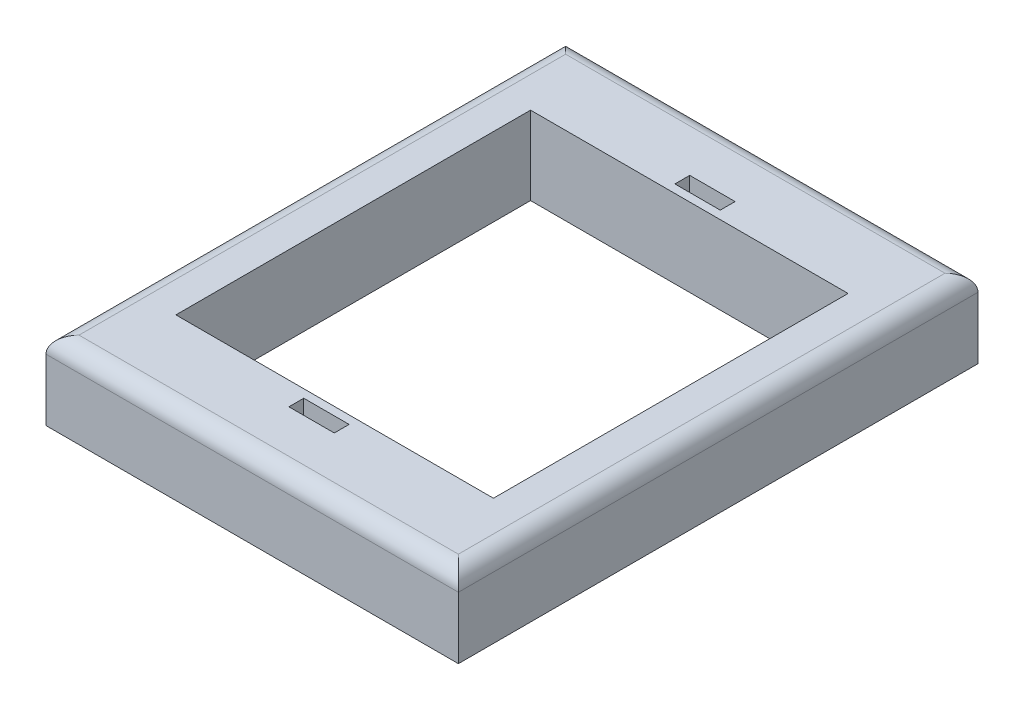
from build123d import *

# Parameters (mm, degrees)
SKETCH1_W           = 50
SKETCH1_H           = 63
SKETCH1_W_2         = 38.5
SKETCH1_H_2         = 43
BOSS_EXTRUDE1_DEPTH = 9.5
SKETCH2_W           = 5.5
SKETCH2_H           = 1.8
CUT_EXTRUDE1_DEPTH  = 64.325897498
FILLET1_R           = 2


with BuildPart() as part:
    # Sketch1 → Boss-Extrude1 (new body)
    with BuildSketch(Plane(origin=(0, 0, 0), x_dir=(1, 0, 0), z_dir=(0, 1, 0))):
        with Locations((-23.459677419, 8.143145161)):
            Rectangle(SKETCH1_W, SKETCH1_H)
        with Locations((-23.459677419, 8.143145161)):
            Rectangle(SKETCH1_W_2, SKETCH1_H_2, mode=Mode.SUBTRACT)
    extrude(amount=BOSS_EXTRUDE1_DEPTH)

    # Sketch2 → Cut-Extrude1 (cut, through all)
    with BuildSketch(Plane(origin=(0, 9.5, 0), x_dir=(1, 0, 0), z_dir=(0, 1, 0))):
        with Locations((-23.459677419, 31.543145161)):
            Rectangle(SKETCH2_W, SKETCH2_H)
        with Locations((-23.459677419, -15.256854839)):
            Rectangle(SKETCH2_W, SKETCH2_H)
    extrude(amount=-CUT_EXTRUDE1_DEPTH, mode=Mode.SUBTRACT)

    # Fillet1
    fillet1_edges = [part.edges().sort_by_distance(p)[0] for p in [
        (-48.459677419, 9.5, -8.143145161),
        (-23.459677419, 9.5, 23.356854839),
        (1.540322581, 9.5, -8.143145161),
        (-23.459677419, 9.5, -39.643145161),
    ]]
    fillet(fillet1_edges, radius=FILLET1_R)


solid = part.part
